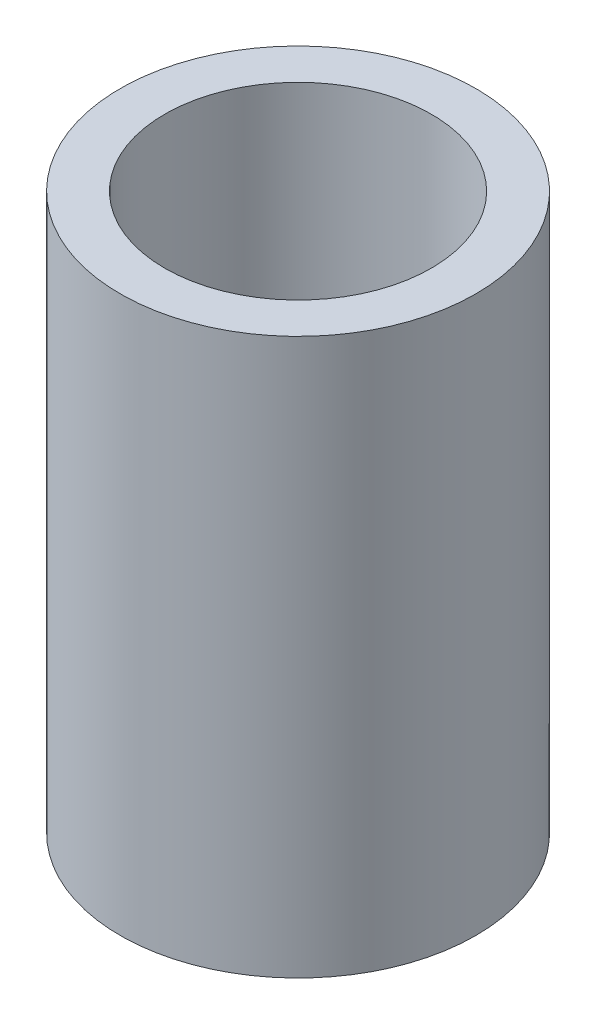
from build123d import *

# Parameters (mm, degrees)
SKETCH1_R           = 8
SKETCH1_R_2         = 6
EXTRUDE_THIN1_DEPTH = 25


with BuildPart() as part:
    # Sketch1 → Extrude-Thin1 (new body)
    with BuildSketch(Plane(origin=(0, 0, 0), x_dir=(1, 0, 0), z_dir=(0, 1, 0))):
        Circle(SKETCH1_R)
        Circle(SKETCH1_R_2, mode=Mode.SUBTRACT)
    extrude(amount=EXTRUDE_THIN1_DEPTH)


solid = part.part
